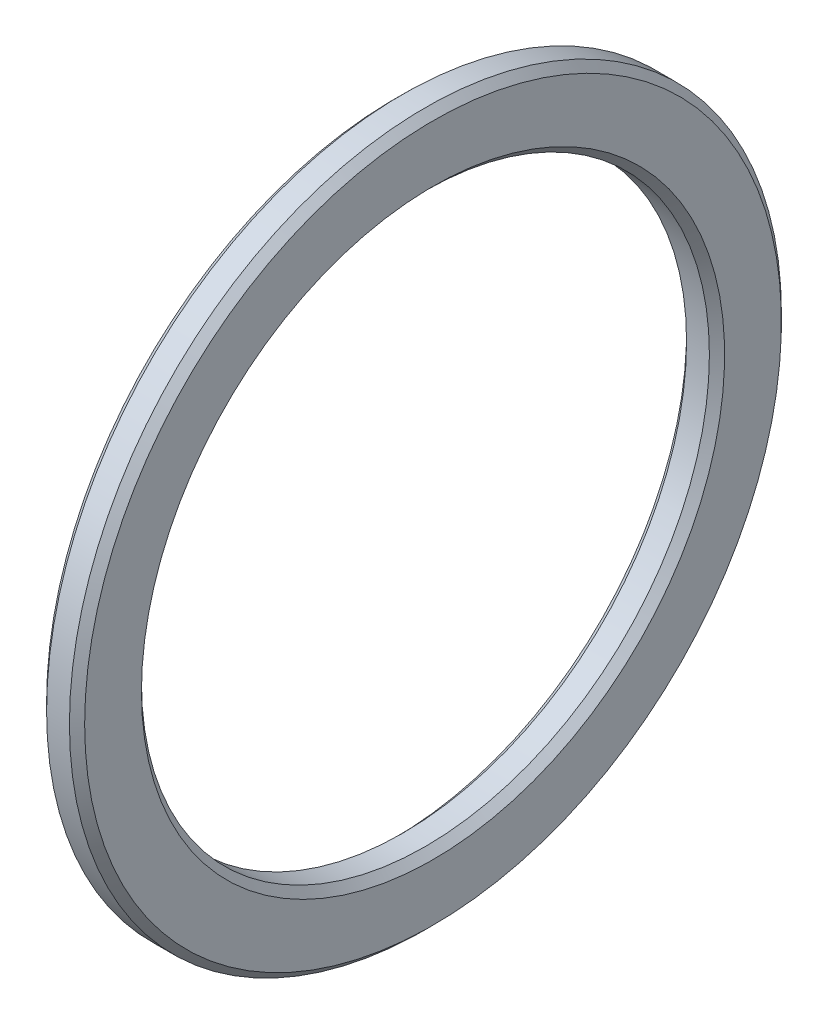
from build123d import *


with BuildPart() as part:
    # Esquisse1 → Révolution1 (revolve)
    with BuildSketch(Plane.XY, mode=Mode.PRIVATE) as r_volution1_sk:
        Polygon((0, 22.88), (0.5, 23.38), (2, 23.38), (2.5, 22.88), (2.5, 19.15), (2, 18.65), (0.5, 18.65), (0, 19.15), align=None)
    revolve(r_volution1_sk.sketch.rotate(Axis((-10.655084746, 0, 0), (1, 0, 0)), 90), axis=Axis((-10.655084746, 0, 0), (1, 0, 0)))


solid = part.part
